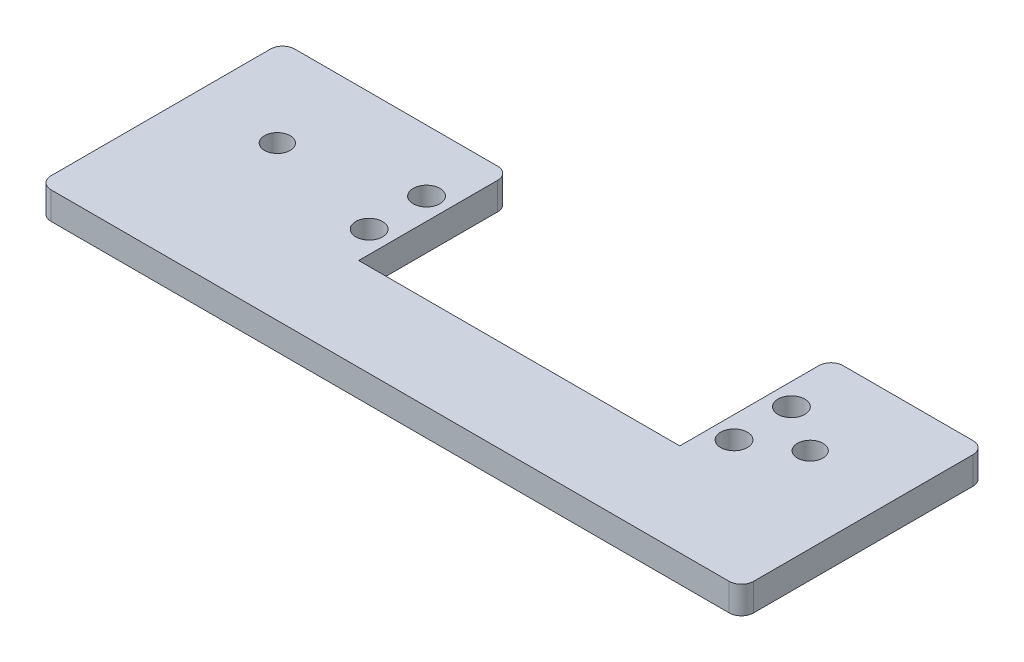
from build123d import *

# Parameters (mm, degrees)
SKETCH1_R           = 2.1082
SKETCH1_R_2         = 2.2
BOSS_EXTRUDE1_DEPTH = 4.5


with BuildPart() as part:
    # Sketch1 → Boss-Extrude1 (new body)
    with BuildSketch(Plane(origin=(0, 0, 0), x_dir=(1, 0, 0), z_dir=(0, 1, 0))):
        with BuildLine():
            Line((55.75, 20.03900351), (34.40167516, 20.03900351))
            ThreePointArc((34.40167516, 20.03900351), (32.987461598, 19.453217073), (32.40167516, 18.03900351))
            Line((32.40167516, 18.03900351), (32.40167516, -4.815996568))
            Line((32.40167516, -4.815996568), (-20.38832484, -4.815996568))
            Line((-20.38832484, -4.815996568), (-20.38832484, 18.03900351))
            ThreePointArc((-20.38832484, 18.03900351), (-20.974111278, 19.453217073), (-22.38832484, 20.03900351))
            Line((-22.38832484, 20.03900351), (-55.75, 20.03900351))
            ThreePointArc((-55.75, 20.03900351), (-57.164213562, 19.453217073), (-57.75, 18.03900351))
            Line((-57.75, 18.03900351), (-57.75, -18.03900351))
            ThreePointArc((-57.75, -18.03900351), (-57.164213562, -19.453217073), (-55.75, -20.03900351))
            Line((-55.75, -20.03900351), (55.75, -20.03900351))
            ThreePointArc((55.75, -20.03900351), (57.164213562, -19.453217073), (57.75, -18.03900351))
            Line((57.75, -18.03900351), (57.75, 18.03900351))
            ThreePointArc((57.75, 18.03900351), (57.164213562, 19.453217073), (55.75, 20.03900351))
        make_face()
        with Locations(Location((-43.8023, 5.219003432, 0), (0, 0, 270))):
            Circle(SKETCH1_R, mode=Mode.SUBTRACT)
        with Locations(Location((43.8023, 5.219003432, 0), (0, 0, 90))):
            Circle(SKETCH1_R, mode=Mode.SUBTRACT)
        with Locations(Location((-23.988324752, 9.934003432, 0), (0, 0, 270))):
            Circle(SKETCH1_R_2, mode=Mode.SUBTRACT)
        with Locations(Location((36.001675072, 9.934003432, 0), (0, 0, 90))):
            Circle(SKETCH1_R_2, mode=Mode.SUBTRACT)
        with Locations(Location((36.001675072, 0.504003432, 0), (0, 0, 270))):
            Circle(SKETCH1_R_2, mode=Mode.SUBTRACT)
        with Locations(Location((-23.988324752, 0.504003432, 0), (0, 0, 90))):
            Circle(SKETCH1_R_2, mode=Mode.SUBTRACT)
    extrude(amount=BOSS_EXTRUDE1_DEPTH)


solid = part.part
